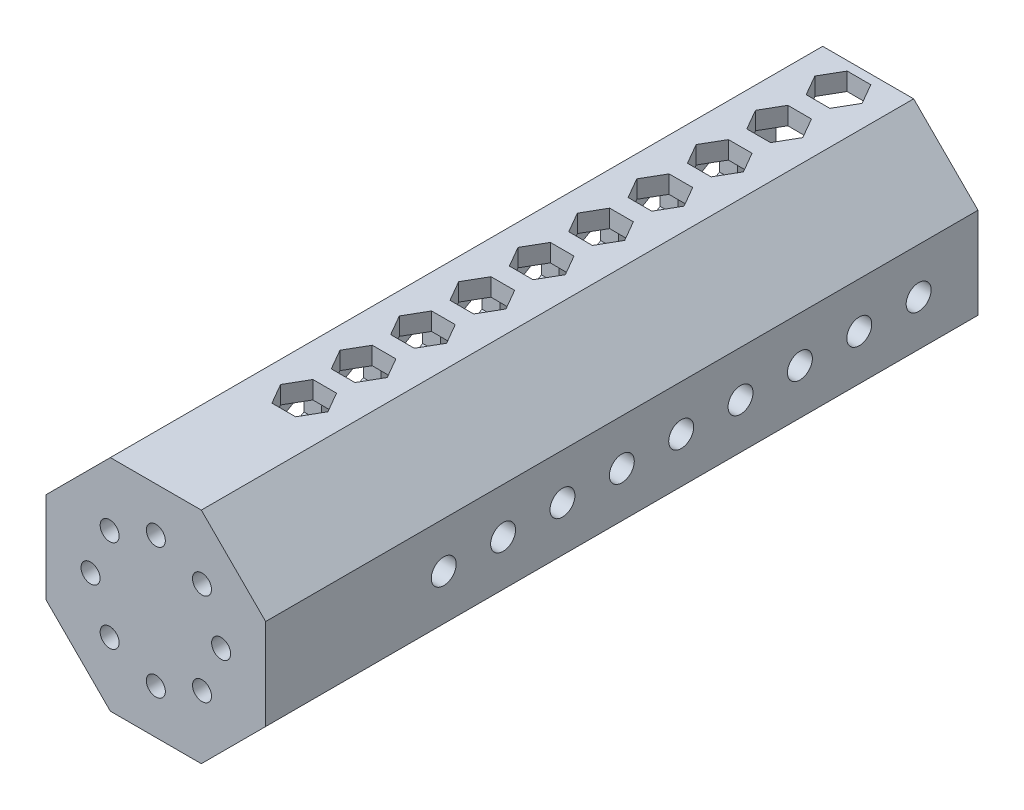
from build123d import *

# Parameters (mm, degrees)
SALIENTE_EXTRUIR1_DEPTH = 60
CROQUIS6_R              = 1.6
CORTAR_EXTRUIR5_DEPTH   = 20
CROQUIS8_R              = 2.1
CORTAR_EXTRUIR8_DEPTH   = 127.930098873
MATRIZL1_COUNT          = 10
MATRIZL1_PITCH          = 10
CROQUIS9_R              = 2.1
CORTAR_EXTRUIR11_DEPTH  = 142.195786056
MATRIZL2_COUNT          = 9
MATRIZL2_PITCH          = 10
CORTAR_EXTRUIR12_START  = -10
CORTAR_EXTRUIR12_DEPTH  = 113.818972476
CORTAR_EXTRUIR13_DEPTH  = 10
MATRIZL3_COUNT          = 9
MATRIZL3_PITCH          = 10
CORTAR_EXTRUIR14_DEPTH  = 10
MATRIZL4_COUNT          = 10
MATRIZL4_PITCH          = 10
CORTAR_EXTRUIR15_DEPTH  = 4


with BuildPart() as part:
    # Croquis1 → Saliente-Extruir1 (new body)
    with BuildSketch(Plane.XY):
        Polygon((18.5, -7.662950904), (18.5, 7.662950904), (7.662950904, 18.5), (-7.662950904, 18.5), (-18.5, 7.662950904), (-18.5, -7.662950904), (-7.662950904, -18.5), (7.662950904, -18.5), align=None)
    saliente_extruir1 = extrude(amount=SALIENTE_EXTRUIR1_DEPTH)

    # Simetría1: Saliente-Extruir1 across plane
    add(saliente_extruir1.mirror(Plane.XY.offset(60)))

    # Croquis6 → Cortar-Extruir5 (cut)
    with BuildSketch(Plane.XY.offset(120)):
        with Locations((0, 11)):
            Circle(CROQUIS6_R)
        with Locations((7.778174593, 7.778174593)):
            Circle(CROQUIS6_R)
        with Locations((11, 0)):
            Circle(CROQUIS6_R)
        with Locations((7.778174593, -7.778174593)):
            Circle(CROQUIS6_R)
        with Locations((0, -11)):
            Circle(CROQUIS6_R)
        with Locations((-7.778174593, -7.778174593)):
            Circle(CROQUIS6_R)
        with Locations((-11, 0)):
            Circle(CROQUIS6_R)
        with Locations((-7.778174593, 7.778174593)):
            Circle(CROQUIS6_R)
    extrude(amount=-CORTAR_EXTRUIR5_DEPTH, mode=Mode.SUBTRACT)

    # Croquis8 → Cortar-Extruir8 (cut, through all)
    with BuildSketch(Plane.XZ.offset(18.5)):
        with Locations((0, 5)):
            Circle(CROQUIS8_R)
    cortar_extruir8 = extrude(amount=-CORTAR_EXTRUIR8_DEPTH, mode=Mode.SUBTRACT)

    # MatrizL1: Cortar-Extruir8 ×10
    with Locations(*[(0, 0, i * MATRIZL1_PITCH) for i in range(1, MATRIZL1_COUNT)]):
        add(cortar_extruir8, mode=Mode.SUBTRACT)

    # Croquis9 → Cortar-Extruir11 (cut, through all)
    with BuildSketch(Plane(origin=(18.5, 0, -15), x_dir=(0, 0, -1), z_dir=(-1, 0, 0))):
        with Locations(Location((-25, 0, 0), (0, 0, 90))):
            Circle(CROQUIS9_R)
    cortar_extruir11 = extrude(amount=CORTAR_EXTRUIR11_DEPTH, mode=Mode.SUBTRACT)

    # MatrizL2: Cortar-Extruir11 ×9
    with Locations(*[(0, 0, i * MATRIZL2_PITCH) for i in range(1, MATRIZL2_COUNT)]):
        add(cortar_extruir11, mode=Mode.SUBTRACT)

    # Croquis10 → Cortar-Extruir12 (cut, through all)
    with BuildSketch(Plane.XY.offset(120).offset(CORTAR_EXTRUIR12_START)):
        Polygon((15.470547209, -6.490959277), (15.529130161, 6.349527519), (6.490959277, 15.470547209), (-6.349527519, 15.529130161), (-15.470547209, 6.490959277), (-15.529130161, -6.349527519), (-6.490959277, -15.470547209), (6.349527519, -15.529130161), align=None)
    extrude(amount=-CORTAR_EXTRUIR12_DEPTH, mode=Mode.SUBTRACT)

    # Croquis11 → Cortar-Extruir13 (cut)
    with BuildSketch(Plane.ZY.offset(18.5)):
        Polygon((90, 3.983716857), (86.55, 1.991858429), (86.55, -1.991858429), (90, -3.983716857), (93.45, -1.991858429), (93.45, 1.991858429), align=None)
    cortar_extruir13 = extrude(amount=-CORTAR_EXTRUIR13_DEPTH, mode=Mode.SUBTRACT)

    # MatrizL3: Cortar-Extruir13 ×9
    with Locations(*[(0, 0, -i * MATRIZL3_PITCH) for i in range(1, MATRIZL3_COUNT)]):
        add(cortar_extruir13, mode=Mode.SUBTRACT)

    # Croquis12 → Cortar-Extruir14 (cut)
    with BuildSketch(Plane(origin=(0, 18.5, 0), x_dir=(1, 0, 0), z_dir=(0, 1, 0))):
        Polygon((3.983716857, -5), (1.991858429, -1.55), (-1.991858429, -1.55), (-3.983716857, -5), (-1.991858429, -8.45), (1.991858429, -8.45), align=None)
    cortar_extruir14 = extrude(amount=-CORTAR_EXTRUIR14_DEPTH, mode=Mode.SUBTRACT)

    # MatrizL4: Cortar-Extruir14 ×10
    with Locations(*[(0, 0, i * MATRIZL4_PITCH) for i in range(1, MATRIZL4_COUNT)]):
        add(cortar_extruir14, mode=Mode.SUBTRACT)

    # Croquis13 → Cortar-Extruir15 (cut)
    with BuildSketch(Plane(origin=(0, 0, 110), x_dir=(-1, 0, 0), z_dir=(0, 0, -1))):
        Polygon((10.84540104, 6.956313744), (10.023540191, 10.023540191), (6.956313744, 10.84540104), (4.710948146, 8.600035443), (5.532808995, 5.532808996), (8.600035443, 4.710948146), align=None)
        Polygon((12.58771324, -2.75), (14.175426481, 0), (12.58771324, 2.75), (9.41228676, 2.75), (7.824573519, 0), (9.41228676, -2.75), align=None)
        Polygon((6.956313744, -10.84540104), (10.023540191, -10.023540191), (10.84540104, -6.956313744), (8.600035443, -4.710948146), (5.532808996, -5.532808995), (4.710948146, -8.600035443), align=None)
        Polygon((-2.75, -12.58771324), (0, -14.175426481), (2.75, -12.58771324), (2.75, -9.41228676), (0, -7.824573519), (-2.75, -9.41228676), align=None)
        Polygon((-10.84540104, -6.956313744), (-10.023540191, -10.023540191), (-6.956313744, -10.84540104), (-4.710948146, -8.600035443), (-5.532808996, -5.532808996), (-8.600035443, -4.710948146), align=None)
        Polygon((-12.58771324, 2.75), (-14.175426481, 0), (-12.58771324, -2.75), (-9.41228676, -2.75), (-7.824573519, 0), (-9.41228676, 2.75), align=None)
        Polygon((-6.956313744, 10.84540104), (-10.023540191, 10.023540191), (-10.84540104, 6.956313744), (-8.600035443, 4.710948146), (-5.532808996, 5.532808996), (-4.710948146, 8.600035443), align=None)
        Polygon((2.75, 12.58771324), (0, 14.175426481), (-2.75, 12.58771324), (-2.75, 9.41228676), (0, 7.824573519), (2.75, 9.41228676), align=None)
    extrude(amount=-CORTAR_EXTRUIR15_DEPTH, mode=Mode.SUBTRACT)


solid = part.part
